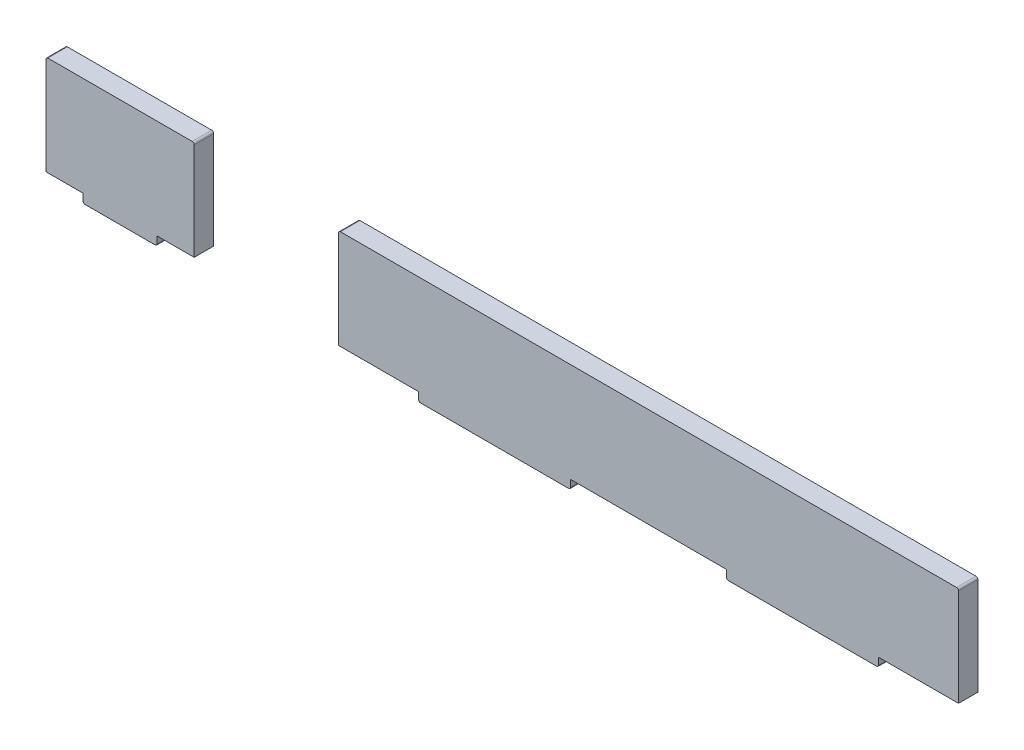
from build123d import *

# Parameters (mm, degrees)
BOSS_EXTRUDE1_DEPTH   = 10
BOSS_EXTRUDE1_2_DEPTH = 10


with BuildPart() as part:
    # Sketch1 → Boss-Extrude1 (new body)
    with BuildSketch(Plane.XY):
        with BuildLine():
            Line((-93.118115932, 2.103915247), (-74.118115932, 2.103915247))
            Line((-74.118115932, 2.103915247), (-74.118115932, 52.103915247))
            ThreePointArc((-74.118115932, 52.103915247), (-74.411009151, 52.811022028), (-75.118115932, 53.103915247))
            Line((-75.118115932, 53.103915247), (-149.118115932, 53.103915247))
            ThreePointArc((-149.118115932, 53.103915247), (-149.825222713, 52.811022028), (-150.118115932, 52.103915247))
            Line((-150.118115932, 52.103915247), (-150.118115932, 2.103915247))
            Line((-150.118115932, 2.103915247), (-131.118115932, 2.103915247))
            Line((-131.118115932, 2.103915247), (-131.118115932, -1.396084753))
            ThreePointArc((-131.118115932, -1.396084753), (-130.825222713, -2.103191534), (-130.118115932, -2.396084753))
            Line((-130.118115932, -2.396084753), (-94.118115932, -2.396084753))
            ThreePointArc((-94.118115932, -2.396084753), (-93.411009151, -2.103191534), (-93.118115932, -1.396084753))
            Line((-93.118115932, -1.396084753), (-93.118115932, 2.103915247))
        make_face()
    extrude(amount=BOSS_EXTRUDE1_DEPTH)


with BuildPart() as body_2:
    # Sketch1 → Boss-Extrude1 2 (new body)
    with BuildSketch(Plane.XY):
        with BuildLine():
            Line((119, 0), (199, 0))
            Line((199, 0), (199, -3.5))
            ThreePointArc((199, -3.5), (199.292893219, -4.207106781), (200, -4.5))
            Line((200, -4.5), (276, -4.5))
            ThreePointArc((276, -4.5), (276.707106781, -4.207106781), (277, -3.5))
            Line((277, -3.5), (277, 0))
            Line((277, 0), (318, 0))
            Line((318, 0), (318, 50))
            ThreePointArc((318, 50), (317.707106781, 50.707106781), (317, 51))
            Line((317, 51), (1, 51))
            ThreePointArc((1, 51), (0.292893219, 50.707106781), (0, 50))
            Line((0, 50), (0, 0))
            Line((0, 0), (41, 0))
            Line((41, 0), (41, -3.5))
            ThreePointArc((41, -3.5), (41.292893219, -4.207106781), (42, -4.5))
            Line((42, -4.5), (118, -4.5))
            ThreePointArc((118, -4.5), (118.707106781, -4.207106781), (119, -3.5))
            Line((119, -3.5), (119, 0))
        make_face()
    extrude(amount=BOSS_EXTRUDE1_2_DEPTH)


solid = Compound([part.part, body_2.part])
